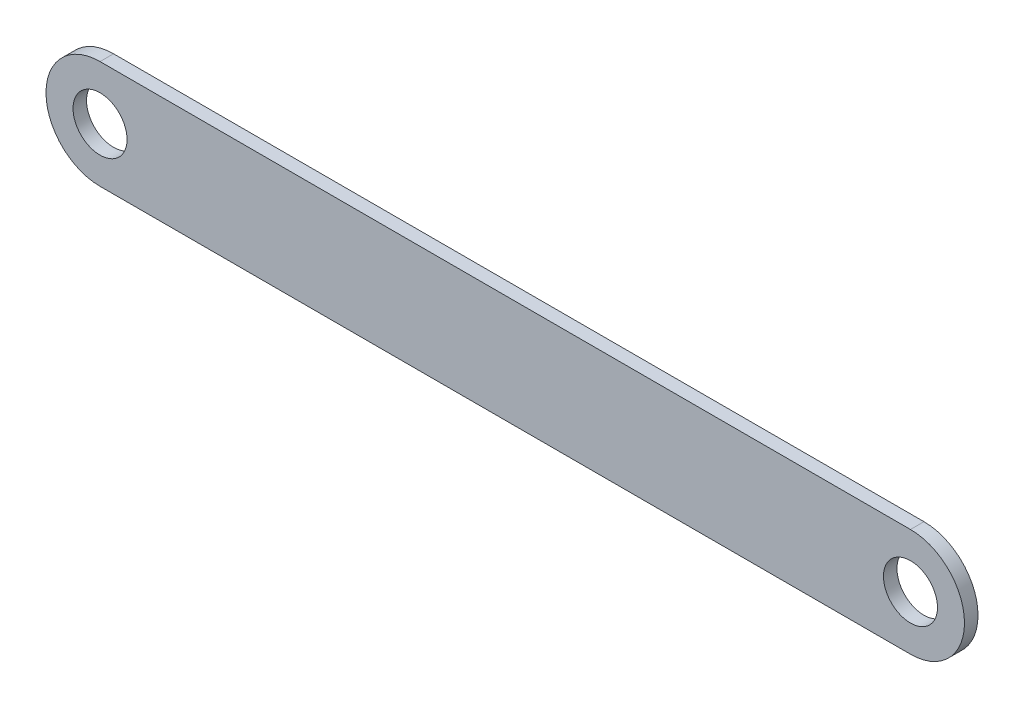
from build123d import *

# Parameters (mm, degrees)
SKETCH_1_R      = 10
EXTRUDE_1_DEPTH = 5


with BuildPart() as part:
    # 草图1 → 凸台-拉伸1 (new body)
    with BuildSketch(Plane.XY):
        with BuildLine():
            Line((0, 20), (300, 20))
            ThreePointArc((300, 20), (320, 0), (300, -20))
            Line((300, -20), (0, -20))
            ThreePointArc((0, -20), (-20, 0), (0, 20))
        make_face()
        Circle(SKETCH_1_R, mode=Mode.SUBTRACT)
        with Locations((300, 0)):
            Circle(SKETCH_1_R, mode=Mode.SUBTRACT)
    extrude(amount=EXTRUDE_1_DEPTH)


solid = part.part
